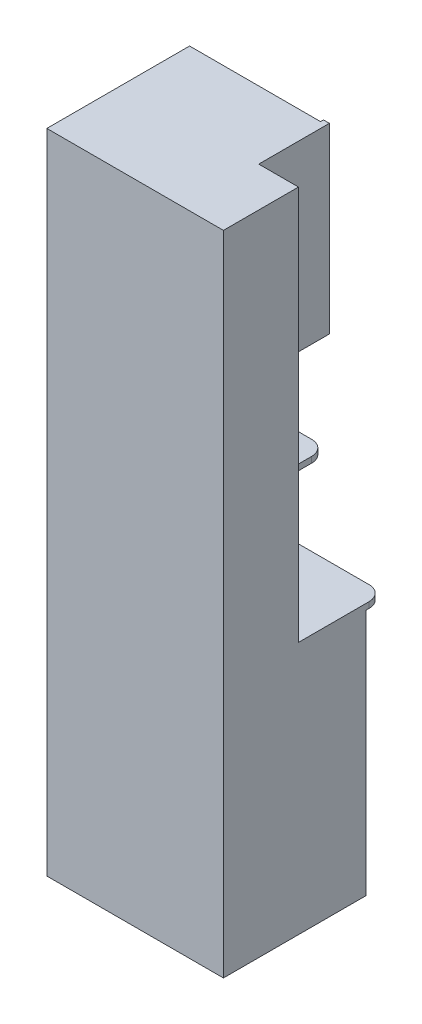
from build123d import *

# Parameters (mm, degrees)
SKETCH_1_W          = 600
SKETCH_1_H          = 2200
EXTRUDE_1_DEPTH     = 485
SKETCH_2_W          = 230
SKETCH_2_H          = 1360
CUT_EXTRUDE_1_DEPTH = 135
SKETCH_3_W          = 230
SKETCH_3_H          = 390
CUT_EXTRUDE_2_DEPTH = 445
SKETCH_4_W          = 230
SKETCH_4_H          = 340
CUT_EXTRUDE_3_DEPTH = 445
SKETCH_5_W          = 580
SKETCH_5_H          = 290
EXTRUDE_2_DEPTH     = 20
FILLET_1_R          = 50
SKETCH_6_W          = 230
SKETCH_6_H          = 610
CUT_EXTRUDE_4_DEPTH = 20
SKETCH_7_W          = 240
SKETCH_7_H          = 620
EXTRUDE_3_DEPTH     = 20
FILLET_2_R          = 50
FILLET_3_R          = 50


with BuildPart() as part:
    # 스케치1 → 보스-돌출1 (new body)
    with BuildSketch(Plane.XY):
        Rectangle(SKETCH_1_W, SKETCH_1_H)
    extrude(amount=-EXTRUDE_1_DEPTH)

    # 스케치2 → 컷-돌출1 (cut)
    with BuildSketch(Plane(origin=(300, 0, 0), x_dir=(0, 0, -1), z_dir=(1, 0, 0))):
        with Locations((370, 420)):
            Rectangle(SKETCH_2_W, SKETCH_2_H)
    extrude(amount=-CUT_EXTRUDE_1_DEPTH, mode=Mode.SUBTRACT)

    # 스케치3 → 컷-돌출2 (cut)
    with BuildSketch(Plane(origin=(165, 0, 0), x_dir=(0, 0, -1), z_dir=(1, 0, 0))):
        with Locations((370, -65)):
            Rectangle(SKETCH_3_W, SKETCH_3_H)
    extrude(amount=-CUT_EXTRUDE_2_DEPTH, mode=Mode.SUBTRACT)

    # 스케치4 → 컷-돌출3 (cut)
    with BuildSketch(Plane(origin=(165, 0, 0), x_dir=(0, 0, -1), z_dir=(1, 0, 0))):
        with Locations((370, 320)):
            Rectangle(SKETCH_4_W, SKETCH_4_H)
    extrude(amount=-CUT_EXTRUDE_3_DEPTH, mode=Mode.SUBTRACT)

    # 스케치5 → 보스-돌출2 (add)
    with BuildSketch(Plane(origin=(0, -260, 0), x_dir=(1, 0, 0), z_dir=(0, 1, 0))):
        with Locations((10, 400)):
            Rectangle(SKETCH_5_W, SKETCH_5_H)
    extrude(amount=EXTRUDE_2_DEPTH)

    # 필렛1
    fillet_1_edges = [part.edges().sort_by_distance(p)[0] for p in [
        (300, -250, -545),
    ]]
    fillet(fillet_1_edges, radius=FILLET_1_R)

    # 스케치6 → 컷-돌출4 (cut)
    with BuildSketch(Plane(origin=(165, 0, 0), x_dir=(0, 0, -1), z_dir=(1, 0, 0))):
        with Locations((370, 795)):
            Rectangle(SKETCH_6_W, SKETCH_6_H)
    extrude(amount=-CUT_EXTRUDE_4_DEPTH, mode=Mode.SUBTRACT)

    # 스케치7 → 보스-돌출3 (add)
    with BuildSketch(Plane(origin=(145, 0, 0), x_dir=(0, 0, -1), z_dir=(1, 0, 0))):
        with Locations((375, 790)):
            Rectangle(SKETCH_7_W, SKETCH_7_H)
    extrude(amount=EXTRUDE_3_DEPTH)

    # 필렛2
    fillet_2_edges = [part.edges().sort_by_distance(p)[0] for p in [
        (-280, -250, -545),
    ]]
    fillet(fillet_2_edges, radius=FILLET_2_R)

    # 필렛3
    fillet_3_edges = [part.edges().sort_by_distance(p)[0] for p in [
        (165, 140, -485),
    ]]
    fillet(fillet_3_edges, radius=FILLET_3_R)


solid = part.part
